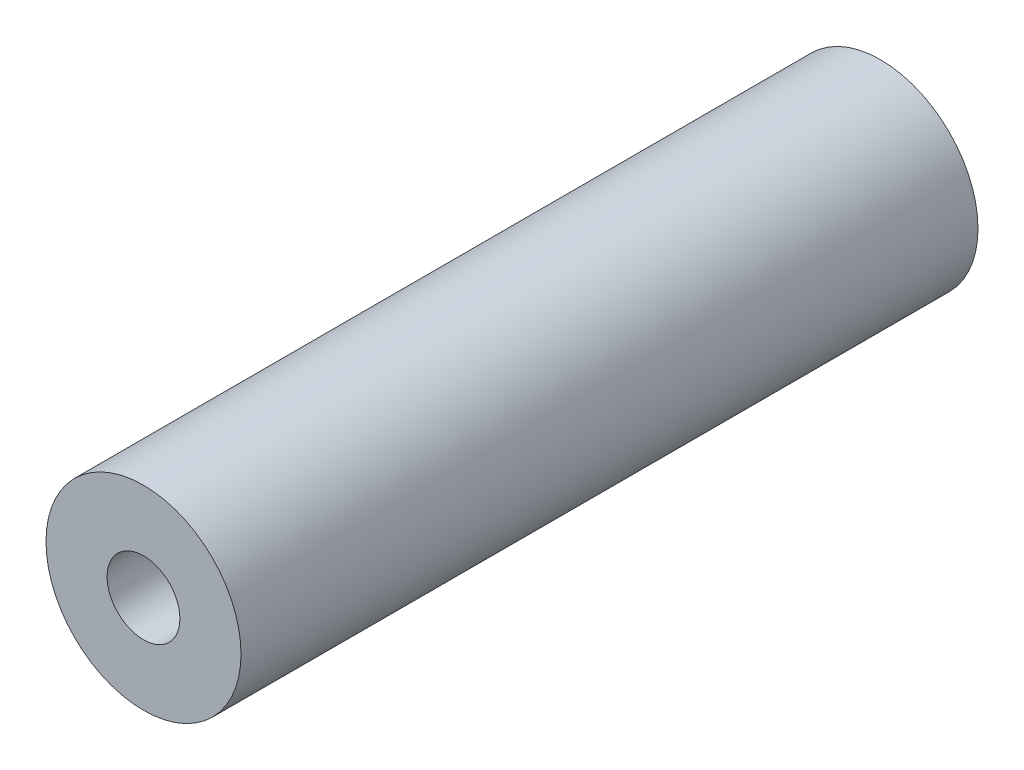
from build123d import *

# Parameters (mm, degrees)
SKETCH1_R             = 2.38125
BOSS_EXTRUDE1_DEPTH   = 18
F_2_56_TAPPED_HOLE1_D = 1.778


with BuildPart() as part:
    # Sketch1 → Boss-Extrude1 (new body)
    with BuildSketch(Plane.XY):
        Circle(SKETCH1_R)
    extrude(amount=BOSS_EXTRUDE1_DEPTH)

    # #2-56 Tapped Hole1 (through all)
    with Locations(Plane.XY.offset(18)):
        with Locations((0, 0)):
            Hole(F_2_56_TAPPED_HOLE1_D / 2)


solid = part.part
